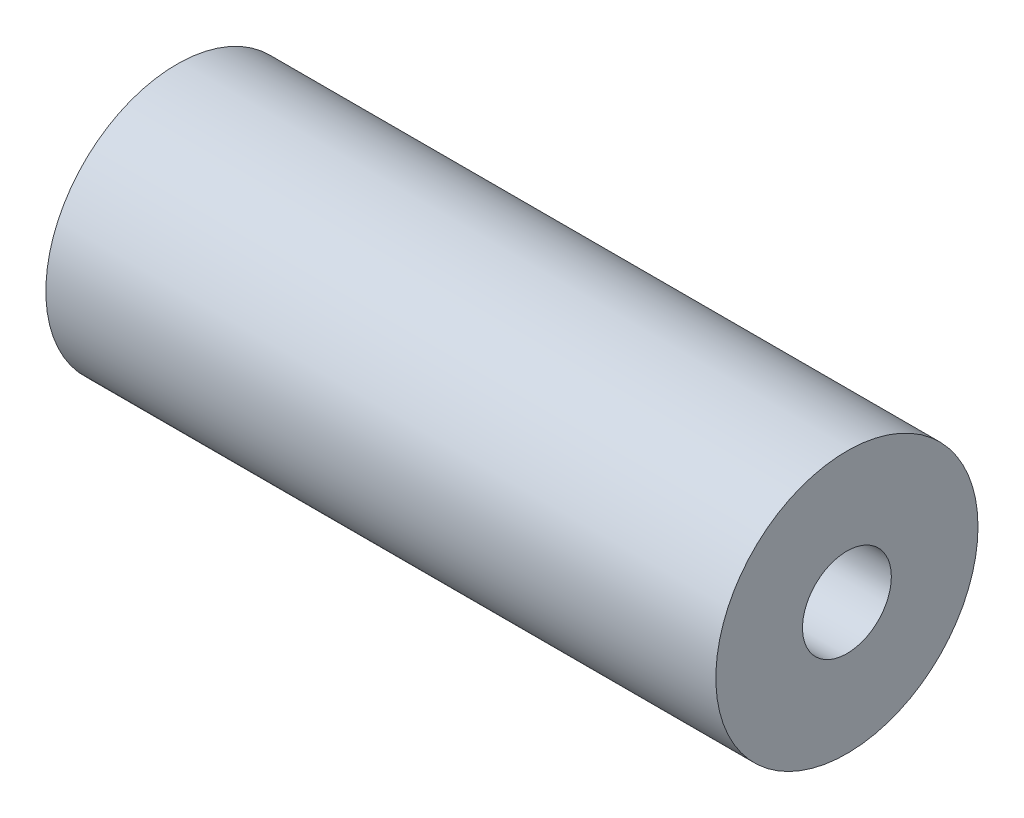
from build123d import *

# Parameters (mm, degrees)
SKETCH1_R           = 4.5
BOSS_EXTRUDE1_DEPTH = 14
SKETCH2_R           = 4.5
BOSS_EXTRUDE2_DEPTH = 2
SKETCH3_R           = 4.5
SKETCH3_R_2         = 1.525
BOSS_EXTRUDE3_DEPTH = 7


with BuildPart() as part:
    # Sketch1 → Boss-Extrude1 (new body)
    with BuildSketch(Plane.YZ):
        with Locations(Location((0, 0, 0), (0, 0, 270))):
            Circle(SKETCH1_R)
        with BuildLine():
            Line((-1.658312395, 2.5), (1.658312395, 2.5))
            ThreePointArc((1.658312395, 2.5), (0, -3), (-1.658312395, 2.5))
        make_face(mode=Mode.SUBTRACT)
    extrude(amount=BOSS_EXTRUDE1_DEPTH)

    # Sketch2 → Boss-Extrude2 (add)
    with BuildSketch(Plane.YZ.offset(14)):
        with Locations(Location((0, 0, 0), (0, 0, 270))):
            Circle(SKETCH2_R)
    extrude(amount=BOSS_EXTRUDE2_DEPTH)

    # Sketch3 → Boss-Extrude3 (add)
    with BuildSketch(Plane.YZ.offset(16)):
        with Locations(Location((0, 0, 0), (0, 0, 270))):
            Circle(SKETCH3_R)
        with Locations(Location((0, 0, 0), (0, 0, 270))):
            Circle(SKETCH3_R_2, mode=Mode.SUBTRACT)
    extrude(amount=BOSS_EXTRUDE3_DEPTH)


solid = part.part
